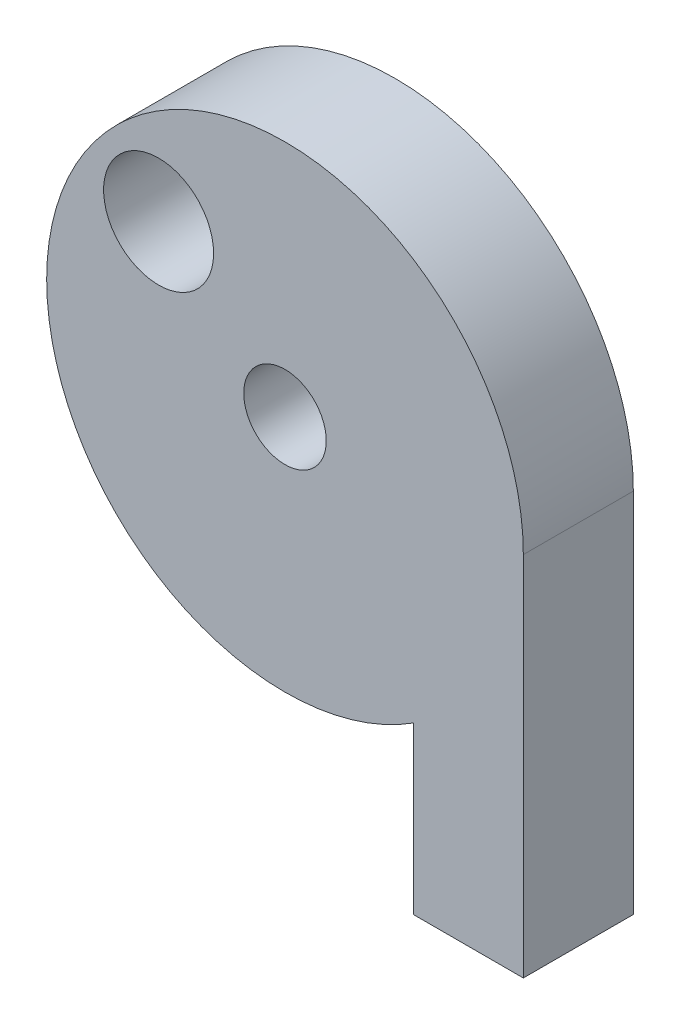
from build123d import *

# Parameters (mm, degrees)
BOSS_EXTRUDE1_DEPTH  = 3
M4_CLEARANCE_HOLE1_D = 4.5
SKETCH5_R            = 2
CUT_EXTRUDE1_DEPTH   = 20
SKETCH8_R            = 3
CUT_EXTRUDE3_DEPTH   = 25.596747752


with BuildPart() as part:
    # Sketch2 → Boss-Extrude1 (new, symmetric)
    with BuildSketch(Plane.XY):
        with BuildLine():
            Line((13, 0), (13, -20))
            Line((13, -20), (7, -20))
            Line((7, -20), (7, -10.95445115))
            ThreePointArc((7, -10.95445115), (-11.401754251, 6.244997998), (13, 0))
        make_face()
    extrude(amount=BOSS_EXTRUDE1_DEPTH, both=True)

    # M4 Clearance Hole1 (through all)
    with Locations(Plane.XY.offset(3)):
        with Locations((0, 0)):
            Hole(M4_CLEARANCE_HOLE1_D / 2)

    # Sketch5 → Cut-Extrude1 (cut)
    with BuildSketch(Plane.XZ.offset(20)):
        with Locations(Location((10, 0, 0), (0, 0, 270))):
            Circle(SKETCH5_R)
    extrude(amount=-CUT_EXTRUDE1_DEPTH, mode=Mode.SUBTRACT)

    # Sketch8 → Cut-Extrude3 (cut, through all)
    with BuildSketch(Plane.XY.offset(-3)):
        with Locations((-6.894399988, 5.785088487)):
            Circle(SKETCH8_R)
    extrude(amount=CUT_EXTRUDE3_DEPTH, mode=Mode.SUBTRACT)


solid = part.part
